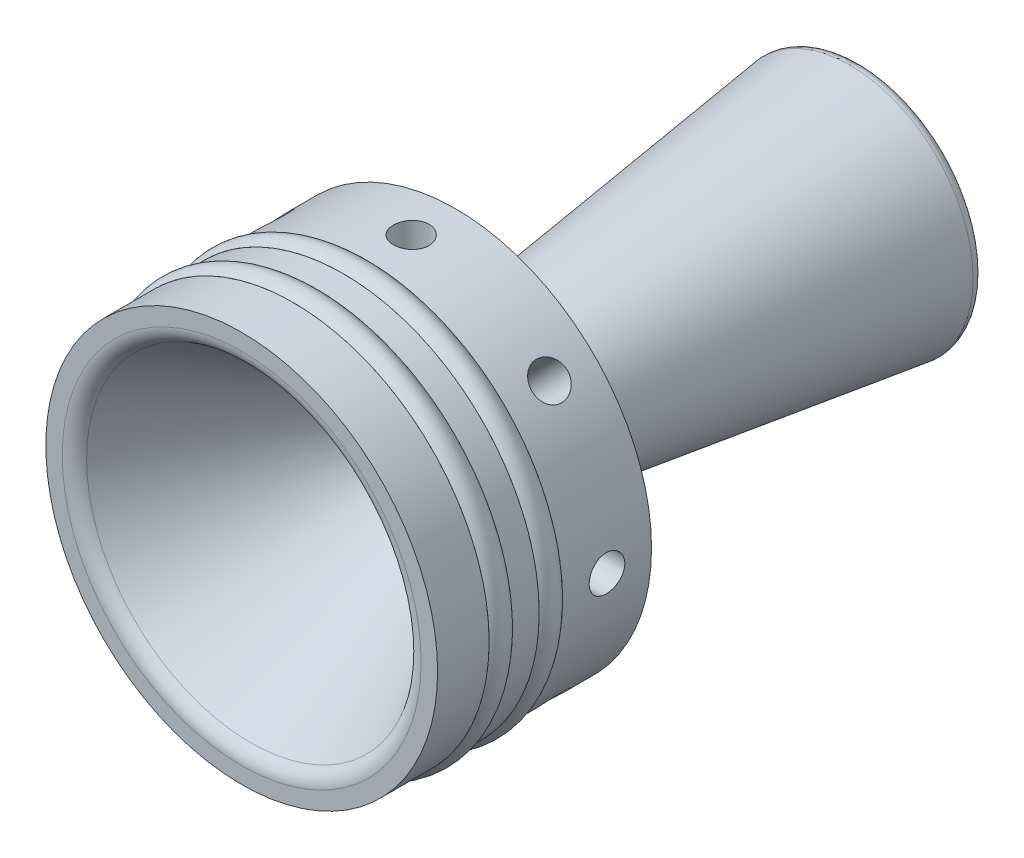
from build123d import *

# Parameters (mm, degrees)
ESBO_O3_R             = 2
CORTE_EXTRUS_O1_DEPTH = 8
PADR_OCIRCULAR1_COUNT = 8
FILETE1_R             = 1
FILETE2_R             = 1
FILETE3_R             = 1
FILETE4_R             = 2
FILETE5_R             = 1


with BuildPart() as part:
    # Esboço1 → Revolução1 (revolve)
    with BuildSketch(Plane(origin=(0, 0, 0), x_dir=(1, 0, 0), z_dir=(0, 1, 0))):
        Polygon((-5, -39.554468212), (-10.95, 5.640268758), (-13.975886882, 5.640268758), (-8.025886882, -39.554468212), (-22, -39.776711279), (-22, -49.776711279), (-20, -49.776711279), (-20, -52.396711279), (-22, -52.396711279), (-22, -55.396711279), (-20, -55.396711279), (-20, -58.016711279), (-22, -58.016711279), (-22, -63.803179518), (-19, -63.803179518), align=None)
    revolve(axis=Axis((0, 0, 0), (0, 0, -1)))

    # Esboço3 → Corte-extrusão1 (cut)
    with BuildSketch(Plane(origin=(0, 22, 0), x_dir=(1, 0, 0), z_dir=(0, 1, 0))):
        with Locations((0, -44.776711279)):
            Circle(ESBO_O3_R)
    corte_extrus_o1 = extrude(amount=-CORTE_EXTRUS_O1_DEPTH, mode=Mode.SUBTRACT)

    # PadrãoCircular1: Corte-extrusão1 ×8 about axis
    padr_ocircular1_axis = Axis((0, 0, 39.776711279), (0, 0, 1))
    for i in range(1, PADR_OCIRCULAR1_COUNT):
        add(corte_extrus_o1.rotate(padr_ocircular1_axis, i * 360 / PADR_OCIRCULAR1_COUNT), mode=Mode.SUBTRACT)

    # Filete1
    filete1_edges = [part.edges().sort_by_distance(p)[0] for p in [
        (13.975886882, 0, -5.640268758),
    ]]
    fillet(filete1_edges, radius=FILETE1_R)

    # Filete2
    filete2_edges = [part.edges().sort_by_distance(p)[0] for p in [
        (10.95, 0, -5.640268758),
    ]]
    fillet(filete2_edges, radius=FILETE2_R)

    # Filete3
    filete3_edges = [part.edges().sort_by_distance(p)[0] for p in [
        (8.025886882, 0, 39.554468212),
    ]]
    fillet(filete3_edges, radius=FILETE3_R)

    # Filete4
    filete4_edges = [part.edges().sort_by_distance(p)[0] for p in [
        (19, 0, 63.803179518),
    ]]
    fillet(filete4_edges, radius=FILETE4_R)

    # Filete5
    filete5_edges = [part.edges().sort_by_distance(p)[0] for p in [
        (5, 0, 39.554468212),
    ]]
    fillet(filete5_edges, radius=FILETE5_R)


with BuildPart() as body_2:
    # Esboço4 → Revolução2 (revolve)
    with BuildSketch(Plane(origin=(0, 0, 0), x_dir=(1, 0, 0), z_dir=(0, 1, 0))):
        with BuildLine():
            ThreePointArc((22, -52.396711279), (22.542619767, -51.086711279), (22, -49.776711279))
            Line((22, -49.776711279), (20, -49.776711279))
            Line((20, -49.776711279), (20, -52.396711279))
            Line((20, -52.396711279), (22, -52.396711279))
        make_face()
        with BuildLine():
            ThreePointArc((22, -58.016711279), (22.542619767, -56.706711279), (22, -55.396711279))
            Line((22, -55.396711279), (20, -55.396711279))
            Line((20, -55.396711279), (20, -58.016711279))
            Line((20, -58.016711279), (22, -58.016711279))
        make_face()
    revolve(axis=Axis((0, 0, 0), (0, 0, 1)))


solid = Compound([part.part, body_2.part])
